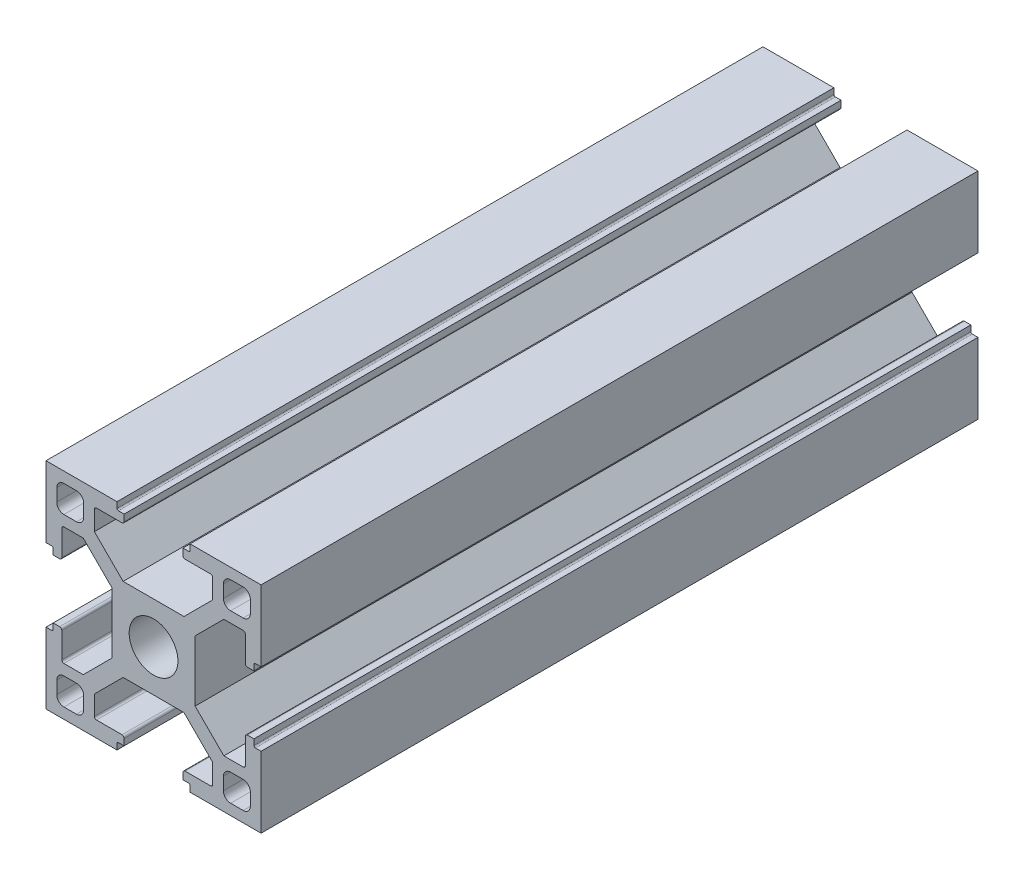
from build123d import *

# Parameters (mm, degrees)
SKETCH_1_R      = 3.4
EXTRUDE_1_DEPTH = 100


with BuildPart() as part:
    # 草图1 → 凸台-拉伸1 (new body)
    with BuildSketch(Plane.XY):
        with BuildLine():
            Line((-23.424024871, 7.005983494), (-23.424024871, -0.394016506))
            Line((-23.424024871, -0.394016506), (-22.624024871, -0.394016506))
            ThreePointArc((-22.624024871, -0.394016506), (-22.482603515, -0.45259515), (-22.424024871, -0.594016506))
            Line((-22.424024871, -0.594016506), (-22.424024871, -1.394016506))
            Line((-22.424024871, -1.394016506), (-21.524024871, -1.394016506))
            ThreePointArc((-21.524024871, -1.394016506), (-21.311892836, -1.306148541), (-21.224024871, -1.094016506))
            Line((-21.224024871, -1.094016506), (-21.224024871, 2.455983494))
            ThreePointArc((-21.224024871, 2.455983494), (-21.136156905, 2.668115528), (-20.924024871, 2.755983494))
            Line((-20.924024871, 2.755983494), (-18.229659789, 2.755983494))
            Line((-18.229659789, 2.755983494), (-14.224024871, -1.249651425))
            Line((-14.224024871, -1.249651425), (-14.224024871, -9.738381588))
            Line((-14.224024871, -9.738381588), (-18.229659789, -13.744016506))
            Line((-18.229659789, -13.744016506), (-20.924024871, -13.744016506))
            ThreePointArc((-20.924024871, -13.744016506), (-21.136156905, -13.656148541), (-21.224024871, -13.444016506))
            Line((-21.224024871, -13.444016506), (-21.224024871, -9.894016506))
            ThreePointArc((-21.224024871, -9.894016506), (-21.311892836, -9.681884472), (-21.524024871, -9.594016506))
            Line((-21.524024871, -9.594016506), (-22.424024871, -9.594016506))
            Line((-22.424024871, -9.594016506), (-22.424024871, -10.394016506))
            ThreePointArc((-22.424024871, -10.394016506), (-22.482603515, -10.535437862), (-22.624024871, -10.594016506))
            Line((-22.624024871, -10.594016506), (-23.424024871, -10.594016506))
            Line((-23.424024871, -10.594016506), (-23.424024871, -17.994016506))
            Line((-23.424024871, -17.994016506), (-23.424024871, -20.494016506))
            Line((-23.424024871, -20.494016506), (-20.924024871, -20.494016506))
            Line((-20.924024871, -20.494016506), (-13.524024871, -20.494016506))
            Line((-13.524024871, -20.494016506), (-13.524024871, -19.694016506))
            ThreePointArc((-13.524024871, -19.694016506), (-13.465446227, -19.55259515), (-13.324024871, -19.494016506))
            Line((-13.324024871, -19.494016506), (-12.524024871, -19.494016506))
            Line((-12.524024871, -19.494016506), (-12.524024871, -18.594016506))
            ThreePointArc((-12.524024871, -18.594016506), (-12.611892836, -18.381884472), (-12.824024871, -18.294016506))
            Line((-12.824024871, -18.294016506), (-16.374024871, -18.294016506))
            ThreePointArc((-16.374024871, -18.294016506), (-16.586156905, -18.206148541), (-16.674024871, -17.994016506))
            Line((-16.674024871, -17.994016506), (-16.674024871, -15.299651425))
            Line((-16.674024871, -15.299651425), (-12.668389952, -11.294016506))
            Line((-12.668389952, -11.294016506), (-4.179659789, -11.294016506))
            Line((-4.179659789, -11.294016506), (-0.174024871, -15.299651425))
            Line((-0.174024871, -15.299651425), (-0.174024871, -17.994016506))
            ThreePointArc((-0.174024871, -17.994016506), (-0.261892836, -18.206148541), (-0.474024871, -18.294016506))
            Line((-0.474024871, -18.294016506), (-4.024024871, -18.294016506))
            ThreePointArc((-4.024024871, -18.294016506), (-4.236156905, -18.381884472), (-4.324024871, -18.594016506))
            Line((-4.324024871, -18.594016506), (-4.324024871, -19.494016506))
            Line((-4.324024871, -19.494016506), (-3.524024871, -19.494016506))
            ThreePointArc((-3.524024871, -19.494016506), (-3.382603515, -19.55259515), (-3.324024871, -19.694016506))
            Line((-3.324024871, -19.694016506), (-3.324024871, -20.494016506))
            Line((-3.324024871, -20.494016506), (4.075975129, -20.494016506))
            Line((4.075975129, -20.494016506), (6.575975129, -20.494016506))
            Line((6.575975129, -20.494016506), (6.575975129, -17.994016506))
            Line((6.575975129, -17.994016506), (6.575975129, -10.594016506))
            Line((6.575975129, -10.594016506), (5.775975129, -10.594016506))
            ThreePointArc((5.775975129, -10.594016506), (5.634553773, -10.535437862), (5.575975129, -10.394016506))
            Line((5.575975129, -10.394016506), (5.575975129, -9.594016506))
            Line((5.575975129, -9.594016506), (4.675975129, -9.594016506))
            ThreePointArc((4.675975129, -9.594016506), (4.463843095, -9.681884472), (4.375975129, -9.894016506))
            Line((4.375975129, -9.894016506), (4.375975129, -13.444016506))
            ThreePointArc((4.375975129, -13.444016506), (4.288107164, -13.656148541), (4.075975129, -13.744016506))
            Line((4.075975129, -13.744016506), (1.381610048, -13.744016506))
            Line((1.381610048, -13.744016506), (-2.624024871, -9.738381588))
            Line((-2.624024871, -9.738381588), (-2.624024871, -1.249651425))
            Line((-2.624024871, -1.249651425), (1.381610048, 2.755983494))
            Line((1.381610048, 2.755983494), (4.075975129, 2.755983494))
            ThreePointArc((4.075975129, 2.755983494), (4.288107164, 2.668115528), (4.375975129, 2.455983494))
            Line((4.375975129, 2.455983494), (4.375975129, -1.094016506))
            ThreePointArc((4.375975129, -1.094016506), (4.463843095, -1.306148541), (4.675975129, -1.394016506))
            Line((4.675975129, -1.394016506), (5.575975129, -1.394016506))
            Line((5.575975129, -1.394016506), (5.575975129, -0.594016506))
            ThreePointArc((5.575975129, -0.594016506), (5.634553773, -0.45259515), (5.775975129, -0.394016506))
            Line((5.775975129, -0.394016506), (6.575975129, -0.394016506))
            Line((6.575975129, -0.394016506), (6.575975129, 7.005983494))
            Line((6.575975129, 7.005983494), (6.575975129, 9.505983494))
            Line((6.575975129, 9.505983494), (4.075975129, 9.505983494))
            Line((4.075975129, 9.505983494), (-3.324024871, 9.505983494))
            Line((-3.324024871, 9.505983494), (-3.324024871, 8.705983494))
            ThreePointArc((-3.324024871, 8.705983494), (-3.382603515, 8.564562138), (-3.524024871, 8.505983494))
            Line((-3.524024871, 8.505983494), (-4.324024871, 8.505983494))
            Line((-4.324024871, 8.505983494), (-4.324024871, 7.605983494))
            ThreePointArc((-4.324024871, 7.605983494), (-4.236156905, 7.393851459), (-4.024024871, 7.305983494))
            Line((-4.024024871, 7.305983494), (-0.474024871, 7.305983494))
            ThreePointArc((-0.474024871, 7.305983494), (-0.261892836, 7.218115528), (-0.174024871, 7.005983494))
            Line((-0.174024871, 7.005983494), (-0.174024871, 4.311618412))
            Line((-0.174024871, 4.311618412), (-4.179659789, 0.305983494))
            Line((-4.179659789, 0.305983494), (-12.668389952, 0.305983494))
            Line((-12.668389952, 0.305983494), (-16.674024871, 4.311618412))
            Line((-16.674024871, 4.311618412), (-16.674024871, 7.005983494))
            ThreePointArc((-16.674024871, 7.005983494), (-16.586156905, 7.218115528), (-16.374024871, 7.305983494))
            Line((-16.374024871, 7.305983494), (-12.824024871, 7.305983494))
            ThreePointArc((-12.824024871, 7.305983494), (-12.611892836, 7.393851459), (-12.524024871, 7.605983494))
            Line((-12.524024871, 7.605983494), (-12.524024871, 8.505983494))
            Line((-12.524024871, 8.505983494), (-13.324024871, 8.505983494))
            ThreePointArc((-13.324024871, 8.505983494), (-13.465446227, 8.564562138), (-13.524024871, 8.705983494))
            Line((-13.524024871, 8.705983494), (-13.524024871, 9.505983494))
            Line((-13.524024871, 9.505983494), (-20.924024871, 9.505983494))
            Line((-20.924024871, 9.505983494), (-23.424024871, 9.505983494))
            Line((-23.424024871, 9.505983494), (-23.424024871, 7.005983494))
        make_face()
        with Locations((-8.424024871, -5.494016506)):
            Circle(SKETCH_1_R, mode=Mode.SUBTRACT)
        with BuildLine():
            Line((2.325975129, -15.244016506), (4.075975129, -15.244016506))
            ThreePointArc((4.075975129, -15.244016506), (4.78308191, -15.536909725), (5.075975129, -16.244016506))
            Line((5.075975129, -16.244016506), (5.075975129, -17.994016506))
            ThreePointArc((5.075975129, -17.994016506), (4.78308191, -18.701123287), (4.075975129, -18.994016506))
            Line((4.075975129, -18.994016506), (2.325975129, -18.994016506))
            ThreePointArc((2.325975129, -18.994016506), (1.618868348, -18.701123287), (1.325975129, -17.994016506))
            Line((1.325975129, -17.994016506), (1.325975129, -16.244016506))
            ThreePointArc((1.325975129, -16.244016506), (1.618868348, -15.536909725), (2.325975129, -15.244016506))
        make_face(mode=Mode.SUBTRACT)
        with BuildLine():
            Line((1.325975129, 5.255983494), (1.325975129, 7.005983494))
            ThreePointArc((1.325975129, 7.005983494), (1.618868348, 7.713090275), (2.325975129, 8.005983494))
            Line((2.325975129, 8.005983494), (4.075975129, 8.005983494))
            ThreePointArc((4.075975129, 8.005983494), (4.78308191, 7.713090275), (5.075975129, 7.005983494))
            Line((5.075975129, 7.005983494), (5.075975129, 5.255983494))
            ThreePointArc((5.075975129, 5.255983494), (4.78308191, 4.548876713), (4.075975129, 4.255983494))
            Line((4.075975129, 4.255983494), (2.325975129, 4.255983494))
            ThreePointArc((2.325975129, 4.255983494), (1.618868348, 4.548876713), (1.325975129, 5.255983494))
        make_face(mode=Mode.SUBTRACT)
        with BuildLine():
            Line((-18.174024871, -16.244016506), (-18.174024871, -17.994016506))
            ThreePointArc((-18.174024871, -17.994016506), (-18.46691809, -18.701123287), (-19.174024871, -18.994016506))
            Line((-19.174024871, -18.994016506), (-20.924024871, -18.994016506))
            ThreePointArc((-20.924024871, -18.994016506), (-21.631131652, -18.701123287), (-21.924024871, -17.994016506))
            Line((-21.924024871, -17.994016506), (-21.924024871, -16.244016506))
            ThreePointArc((-21.924024871, -16.244016506), (-21.631131652, -15.536909725), (-20.924024871, -15.244016506))
            Line((-20.924024871, -15.244016506), (-19.174024871, -15.244016506))
            ThreePointArc((-19.174024871, -15.244016506), (-18.46691809, -15.536909725), (-18.174024871, -16.244016506))
        make_face(mode=Mode.SUBTRACT)
        with BuildLine():
            Line((-19.174024871, 4.255983494), (-20.924024871, 4.255983494))
            ThreePointArc((-20.924024871, 4.255983494), (-21.631131652, 4.548876713), (-21.924024871, 5.255983494))
            Line((-21.924024871, 5.255983494), (-21.924024871, 7.005983494))
            ThreePointArc((-21.924024871, 7.005983494), (-21.631131652, 7.713090275), (-20.924024871, 8.005983494))
            Line((-20.924024871, 8.005983494), (-19.174024871, 8.005983494))
            ThreePointArc((-19.174024871, 8.005983494), (-18.46691809, 7.713090275), (-18.174024871, 7.005983494))
            Line((-18.174024871, 7.005983494), (-18.174024871, 5.255983494))
            ThreePointArc((-18.174024871, 5.255983494), (-18.46691809, 4.548876713), (-19.174024871, 4.255983494))
        make_face(mode=Mode.SUBTRACT)
    extrude(amount=EXTRUDE_1_DEPTH)


solid = part.part
